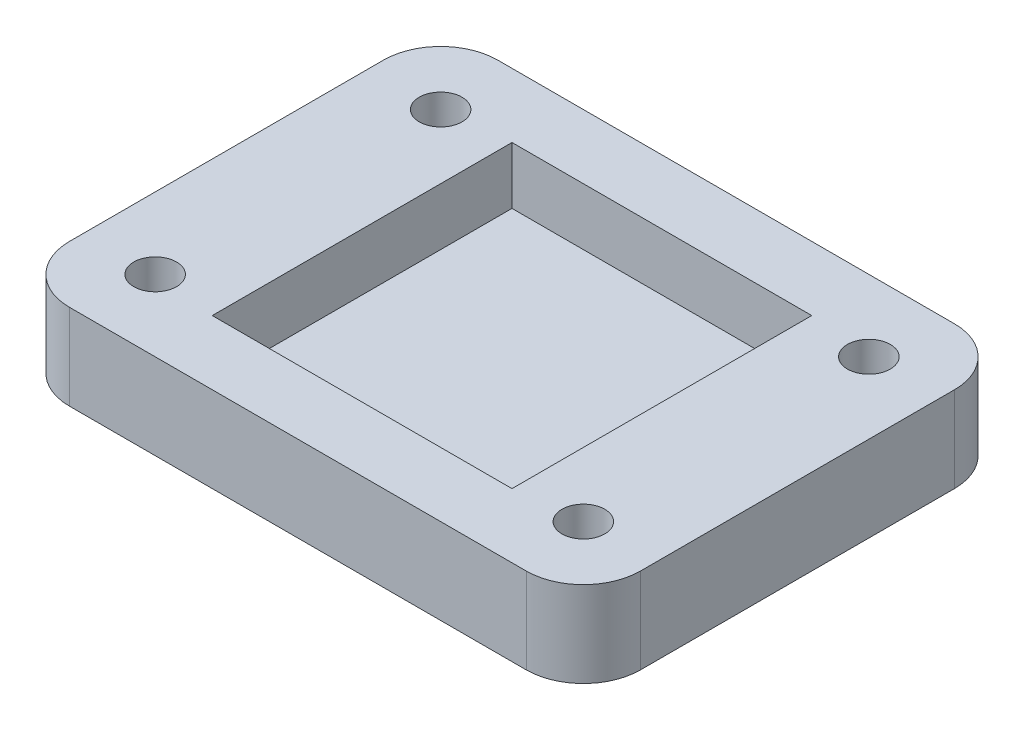
from build123d import *

# Parameters (mm, degrees)
SKETCH1_W           = 40
SKETCH1_H           = 30
BOSS_EXTRUDE1_DEPTH = 6
SKETCH2_R           = 1.5
CUT_EXTRUDE1_DEPTH  = 6
FILLET1_R           = 4
SKETCH3_W           = 21
SKETCH3_H           = 21
CUT_EXTRUDE2_DEPTH  = 4


with BuildPart() as part:
    # Sketch1 → Boss-Extrude1 (new body)
    with BuildSketch(Plane(origin=(0, 0, 0), x_dir=(1, 0, 0), z_dir=(0, 1, 0))):
        with Locations((20, 15)):
            Rectangle(SKETCH1_W, SKETCH1_H)
    extrude(amount=BOSS_EXTRUDE1_DEPTH)

    # Sketch2 → Cut-Extrude1 (cut)
    with BuildSketch(Plane(origin=(0, 6, 0), x_dir=(1, 0, 0), z_dir=(0, 1, 0))):
        with Locations(Location((5, 5, 0), (0, 0, 270))):
            Circle(SKETCH2_R)
        with Locations(Location((5, 25, 0), (0, 0, 90))):
            Circle(SKETCH2_R)
        with Locations(Location((35, 5, 0), (0, 0, 90))):
            Circle(SKETCH2_R)
        with Locations(Location((35, 25, 0), (0, 0, 270))):
            Circle(SKETCH2_R)
    extrude(amount=-CUT_EXTRUDE1_DEPTH, mode=Mode.SUBTRACT)

    # Fillet1
    fillet1_edges = [part.edges().sort_by_distance(p)[0] for p in [
        (0, 3, -30),
        (40, 3, -30),
        (40, 3, 0),
        (0, 3, 0),
    ]]
    fillet(fillet1_edges, radius=FILLET1_R)

    # Sketch3 → Cut-Extrude2 (cut)
    with BuildSketch(Plane(origin=(0, 6, 0), x_dir=(1, 0, 0), z_dir=(0, 1, 0))):
        with Locations((20, 15)):
            Rectangle(SKETCH3_W, SKETCH3_H)
    extrude(amount=-CUT_EXTRUDE2_DEPTH, mode=Mode.SUBTRACT)


solid = part.part
